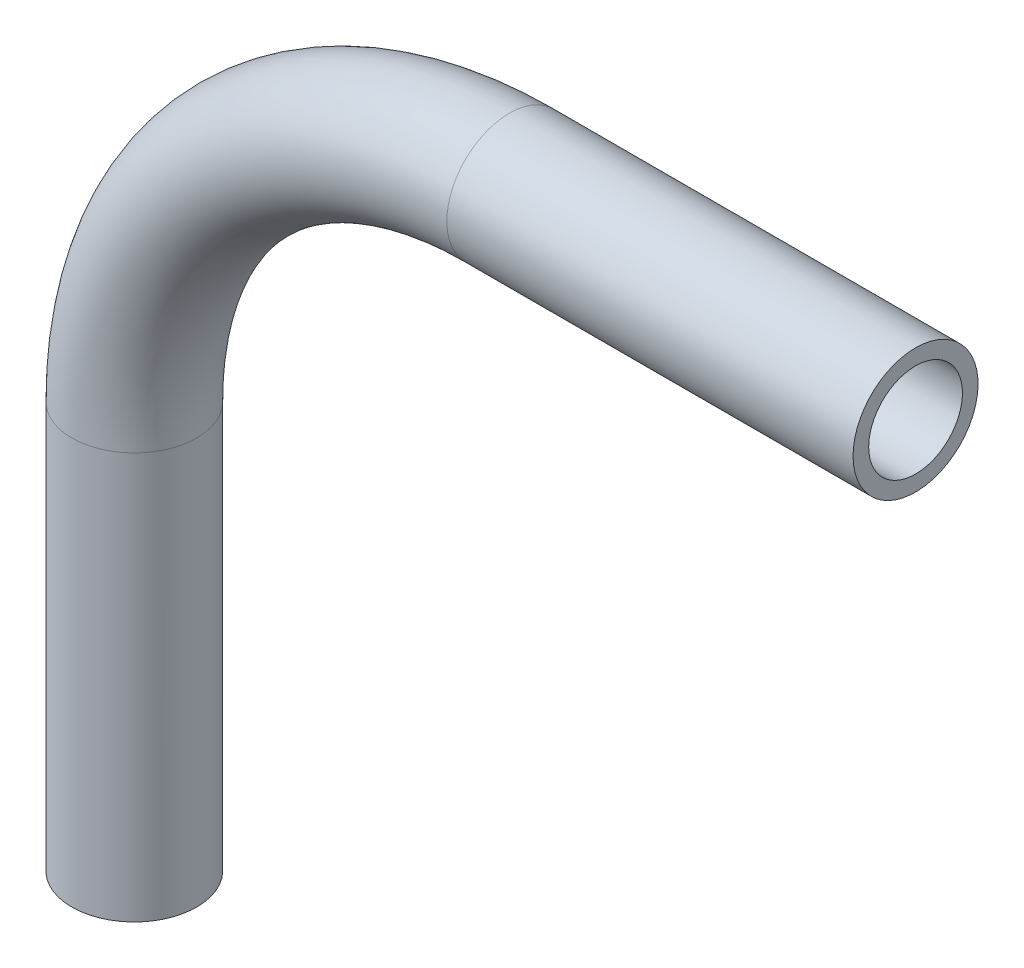
from build123d import *

# Parameters (mm, degrees)
SKETCH2_R   = 4
SKETCH2_R_2 = 3


with BuildPart() as part:
    # Sweep1: sweep along a path in Sketch1
    with BuildLine(Plane.XY) as sweep1_path:
        Line((0, 0), (0, 26))
        ThreePointArc((0, 26), (7.029437252, 42.970562748), (24, 50))
        Line((24, 50), (50, 50))
    # Sketch2 → Sweep1 (sweep)
    with BuildSketch(Plane(origin=(0, 0, 0), x_dir=(1, 0, 0), z_dir=(0, 1, 0))):
        Circle(SKETCH2_R)
        Circle(SKETCH2_R_2, mode=Mode.SUBTRACT)
    sweep(path=sweep1_path.line)


solid = part.part
